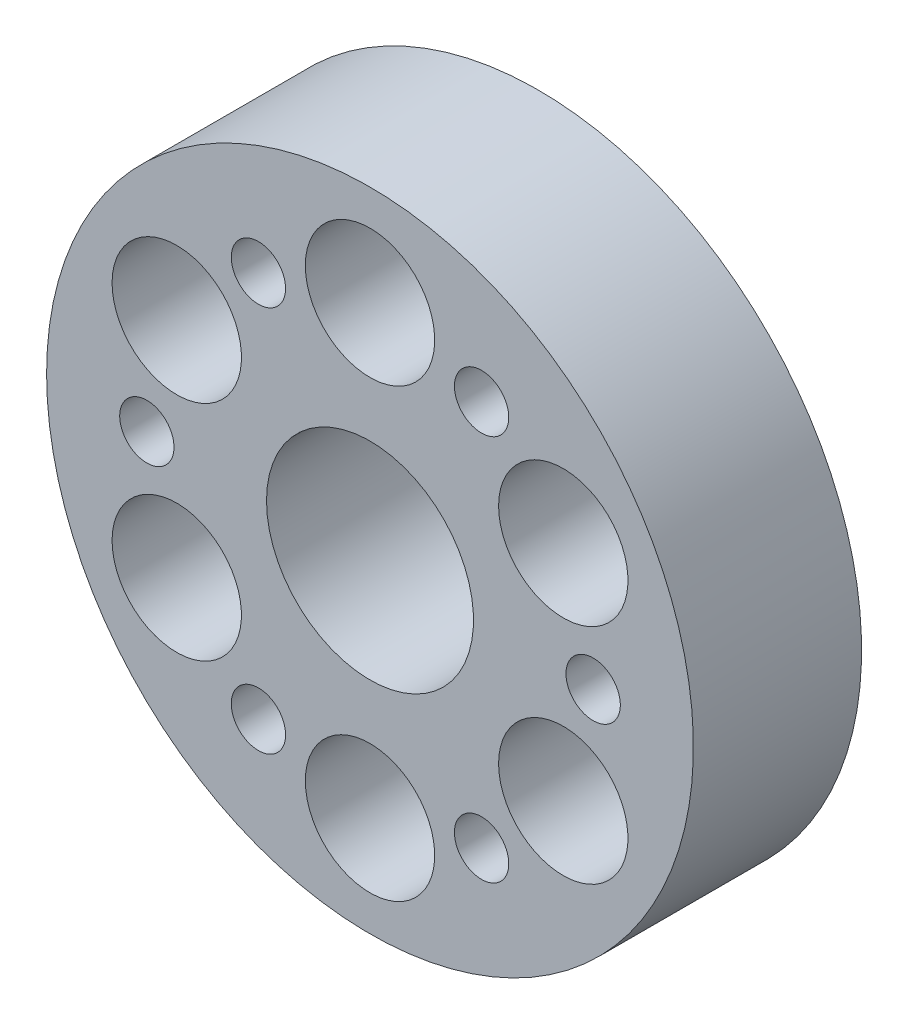
from build123d import *

# Parameters (mm, degrees)
SKETCH_1_R      = 25
SKETCH_1_R_2    = 8
SKETCH_1_R_3    = 2.1
SKETCH_1_R_4    = 5
EXTRUDE_2_DEPTH = 13


with BuildPart() as part:
    # 草图1 → 凸台-拉伸2 (new body)
    with BuildSketch(Plane.XY):
        with Locations(Location((0, 0, 0), (0, 0, 180))):
            Circle(SKETCH_1_R)
        with Locations(Location((0, 0, 0), (0, 0, 180))):
            Circle(SKETCH_1_R_2, mode=Mode.SUBTRACT)
        with Locations(Location((8.625, 14.938938215, 0), (0, 0, 180))):
            Circle(SKETCH_1_R_3, mode=Mode.SUBTRACT)
        with Locations(Location((17.25, 0, 0), (0, 0, 180))):
            Circle(SKETCH_1_R_3, mode=Mode.SUBTRACT)
        with Locations(Location((8.625, -14.938938215, 0), (0, 0, 180))):
            Circle(SKETCH_1_R_3, mode=Mode.SUBTRACT)
        with Locations(Location((-8.625, -14.938938215, 0), (0, 0, 180))):
            Circle(SKETCH_1_R_3, mode=Mode.SUBTRACT)
        with Locations(Location((-17.25, 0, 0), (0, 0, 180))):
            Circle(SKETCH_1_R_3, mode=Mode.SUBTRACT)
        with Locations(Location((-8.625, 14.938938215, 0), (0, 0, 180))):
            Circle(SKETCH_1_R_3, mode=Mode.SUBTRACT)
        with Locations(Location((0, 17.25, 0), (0, 0, 180))):
            Circle(SKETCH_1_R_4, mode=Mode.SUBTRACT)
        with Locations(Location((14.938938215, 8.625, 0), (0, 0, 180))):
            Circle(SKETCH_1_R_4, mode=Mode.SUBTRACT)
        with Locations(Location((14.938938215, -8.625, 0), (0, 0, 180))):
            Circle(SKETCH_1_R_4, mode=Mode.SUBTRACT)
        with Locations(Location((-14.938938215, -8.625, 0), (0, 0, 180))):
            Circle(SKETCH_1_R_4, mode=Mode.SUBTRACT)
        with Locations(Location((-14.938938215, 8.625, 0), (0, 0, 180))):
            Circle(SKETCH_1_R_4, mode=Mode.SUBTRACT)
        with Locations(Location((0, -17.25, 0), (0, 0, 180))):
            Circle(SKETCH_1_R_4, mode=Mode.SUBTRACT)
    extrude(amount=EXTRUDE_2_DEPTH)


solid = part.part
